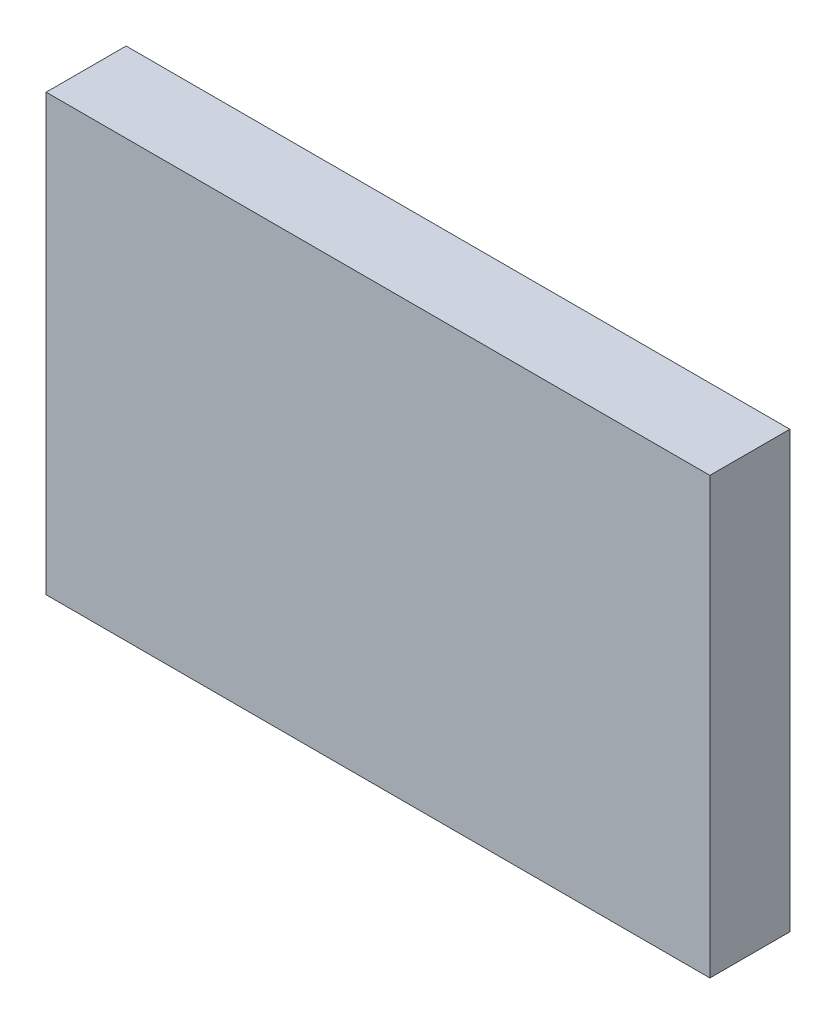
from build123d import *

# Parameters (mm, degrees)
ESQUISSE1_W        = 52.3
ESQUISSE1_H        = 34.3
BOSS_EXTRU_1_DEPTH = 6.3


with BuildPart() as part:
    # Esquisse1 → Boss.-Extru.1 (new body)
    with BuildSketch(Plane.XY):
        with Locations((-13.215911209, -5.632432432)):
            Rectangle(ESQUISSE1_W, ESQUISSE1_H)
    extrude(amount=BOSS_EXTRU_1_DEPTH)


solid = part.part
